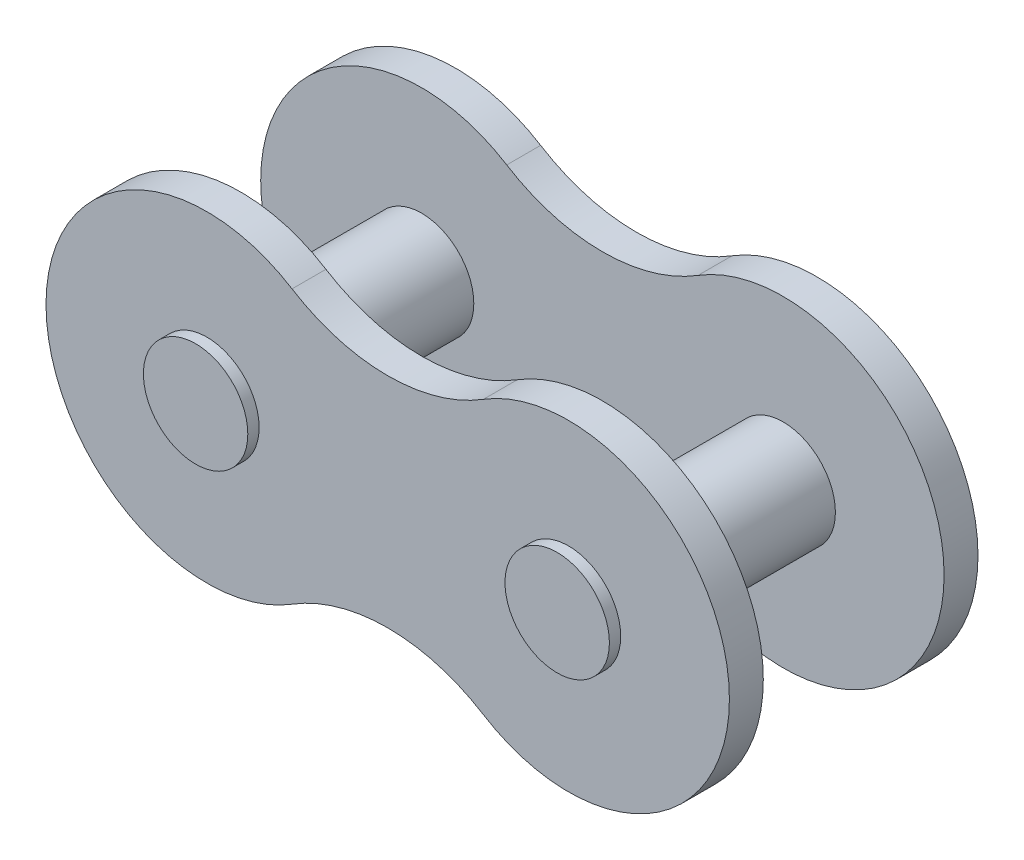
from build123d import *

# Parameters (mm, degrees)
BOSS_EXTRUDE1_DEPTH      = 0.75
BOSS_EXTRUDE2_DEPTH      = 5
BOSS_EXTRUDE2_DEPTH_BACK = 1
SKETCH2_R                = 1.155


with BuildPart() as part:
    # Sketch1 → Boss-Extrude1 (new body)
    with BuildSketch(Plane.XY):
        with BuildLine():
            ThreePointArc((-2.116402116, 3.020870572), (-7.56, 0), (-2.116402116, -3.020870572))
            ThreePointArc((-2.116402116, -3.020870572), (0, -2.41510717), (2.116402116, -3.020870572))
            ThreePointArc((2.116402116, -3.020870572), (7.56, 0), (2.116402116, 3.020870572))
            ThreePointArc((2.116402116, 3.020870572), (0, 2.41510717), (-2.116402116, 3.020870572))
        make_face()
    boss_extrude1 = extrude(amount=BOSS_EXTRUDE1_DEPTH)

    # Sketch2 → Boss-Extrude2 (add, two sides: drawn at the far end of the back side and taken through both)
    with BuildSketch(Plane.XY.offset(0.75).offset(-BOSS_EXTRUDE2_DEPTH_BACK)):
        with Locations((-4, 0)):
            Circle(SKETCH2_R)
        with Locations((4, 0)):
            Circle(SKETCH2_R)
    extrude(amount=BOSS_EXTRUDE2_DEPTH + BOSS_EXTRUDE2_DEPTH_BACK)

    # Mirror1: Boss-Extrude1 across plane
    add(boss_extrude1.mirror(Plane.XY.offset(2.75)))


solid = part.part
